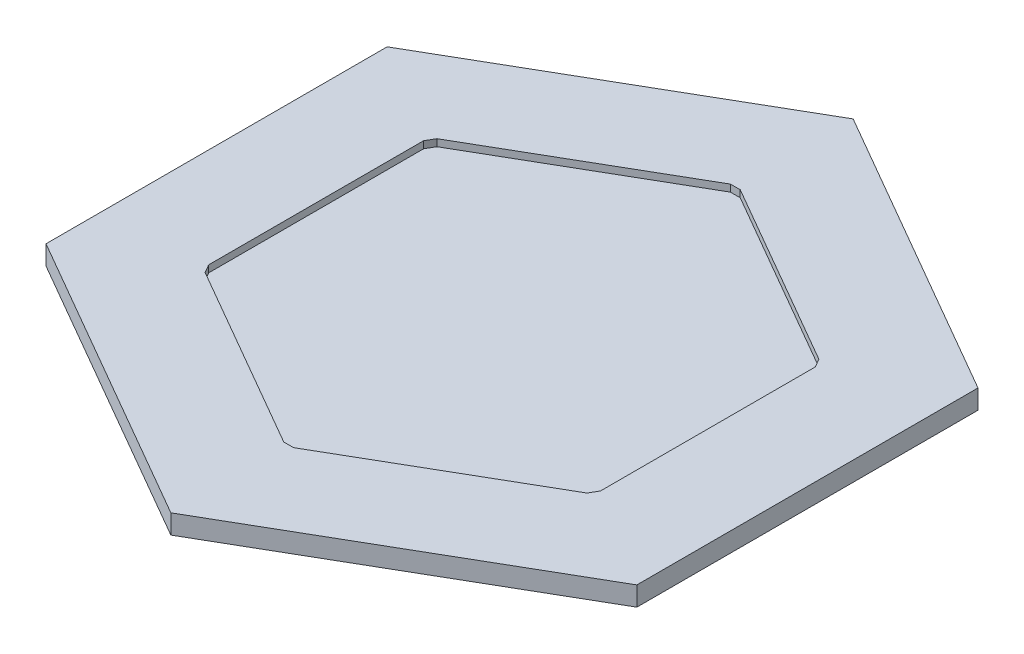
from build123d import *

# Parameters (mm, degrees)
BOSS_EXTRUDE2_DEPTH = 1.7
BOSS_EXTRUDE3_DEPTH = 3


with BuildPart() as part:
    # Sketch3 → Boss-Extrude2 (new body)
    with BuildSketch(Plane(origin=(0, 0, 0), x_dir=(1, 0, 0), z_dir=(0, 1, 0))):
        Polygon((0, -83.094010768), (71.961524227, -41.547005384), (71.961524227, 41.547005384), (0, 83.094010768), (-71.961524227, 41.547005384), (-71.961524227, -41.547005384), align=None)
        Polygon((-1.192537669, 54.404010768), (-46.518986558, 28.2347733), (-47.711524227, 26.169237467), (-47.711524227, -26.169237467), (-46.518986558, -28.2347733), (-1.192537669, -54.404010768), (1.192537669, -54.404010768), (46.518986558, -28.2347733), (47.711524227, -26.169237467), (47.711524227, 26.169237467), (46.518986558, 28.2347733), (1.192537669, 54.404010768), align=None, mode=Mode.SUBTRACT)
    extrude(amount=BOSS_EXTRUDE2_DEPTH)

    # Sketch6 → Boss-Extrude3 (add)
    with BuildSketch(Plane.XZ):
        Polygon((0, 83.094010768), (-71.961524227, 41.547005384), (-71.961524227, -41.547005384), (0, -83.094010768), (71.961524227, -41.547005384), (71.961524227, 41.547005384), align=None)
    extrude(amount=BOSS_EXTRUDE3_DEPTH)


solid = part.part
